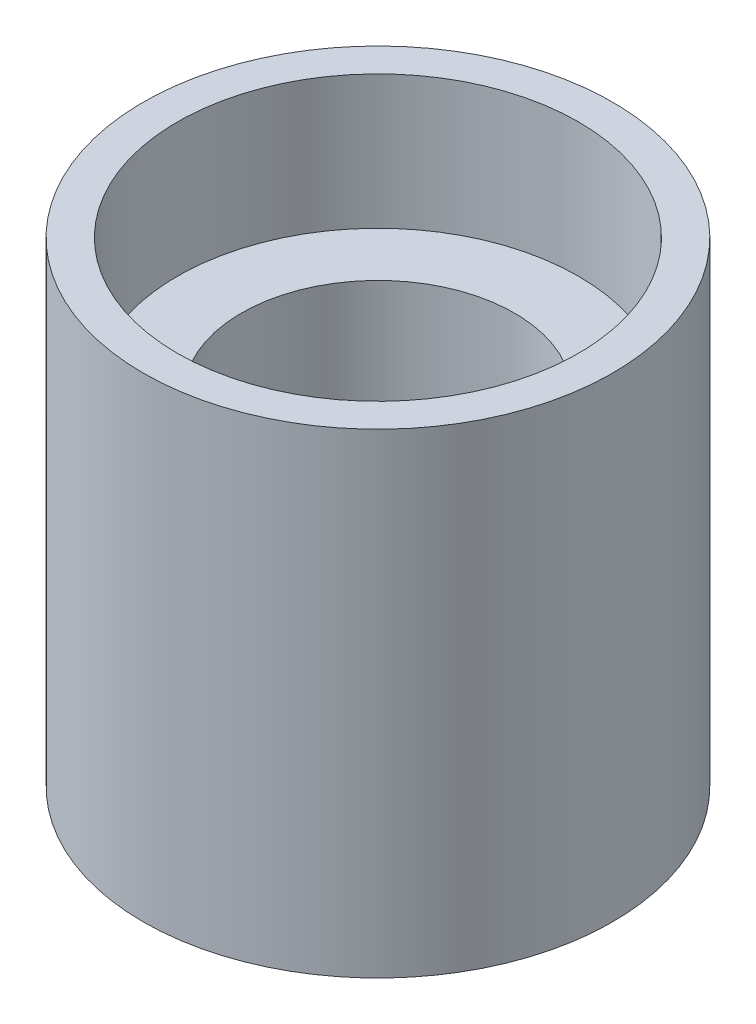
from build123d import *

# Parameters (mm, degrees)
SKETCH1_R           = 7.9
SKETCH1_R_2         = 4.6
BOSS_EXTRUDE1_DEPTH = 16
SKETCH2_R           = 6.75
CUT_EXTRUDE1_DEPTH  = 4.5


with BuildPart() as part:
    # Sketch1 → Boss-Extrude1 (new body)
    with BuildSketch(Plane(origin=(0, 0, 0), x_dir=(1, 0, 0), z_dir=(0, 1, 0))):
        with Locations(Location((0, 0, 0), (0, 0, 270))):
            Circle(SKETCH1_R)
        with Locations(Location((0, 0, 0), (0, 0, 270))):
            Circle(SKETCH1_R_2, mode=Mode.SUBTRACT)
    extrude(amount=BOSS_EXTRUDE1_DEPTH)

    # Sketch2 → Cut-Extrude1 (cut)
    with BuildSketch(Plane(origin=(0, 16, 0), x_dir=(1, 0, 0), z_dir=(0, 1, 0))):
        with Locations(Location((0, 0, 0), (0, 0, 270))):
            Circle(SKETCH2_R)
    extrude(amount=-CUT_EXTRUDE1_DEPTH, mode=Mode.SUBTRACT)


solid = part.part
